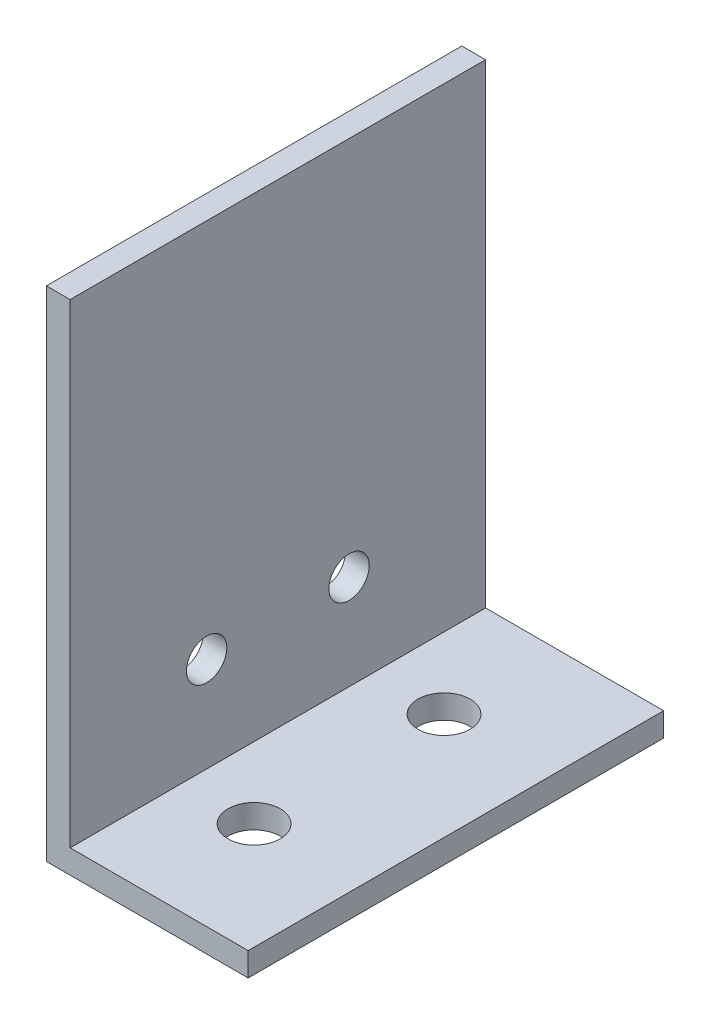
from build123d import *

# Parameters (mm, degrees)
EXTRUDE_1_DEPTH     = 35
CUT_EXTRUDE_1_REACH = 57.803
SKETCH_2_R          = 2.2
SKETCH_3_R          = 1.7
CUT_EXTRUDE_2_DEPTH = 58.253820833


with BuildPart() as part:
    # 草图1 → 凸台-拉伸1 (new body)
    with BuildSketch(Plane.XY):
        Polygon((0, 0), (0, 42), (2, 42), (2, 2), (17, 2), (17, 0), align=None)
    extrude(amount=EXTRUDE_1_DEPTH)

    # 草图2 → 切除-拉伸1 (cut, up to next)
    with BuildSketch(Plane(origin=(0, 2, 0), x_dir=(1, 0, 0), z_dir=(0, 1, 0)), mode=Mode.PRIVATE) as cut_extrude_1_sk1:
        with Locations(Location((8, -9.5, 0), (0, 0, 180))):
            Circle(SKETCH_2_R)
    cut_extrude_1_tool1 = extrude(cut_extrude_1_sk1.sketch, amount=-CUT_EXTRUDE_1_REACH, mode=Mode.PRIVATE) & part.part
    # 草图2 → 切除-拉伸1 (cut, up to next)
    with BuildSketch(Plane(origin=(0, 2, 0), x_dir=(1, 0, 0), z_dir=(0, 1, 0)), mode=Mode.PRIVATE) as cut_extrude_1_sk2:
        with Locations(Location((8, -25.5, 0), (0, 0, 180))):
            Circle(SKETCH_2_R)
    cut_extrude_1_tool2 = extrude(cut_extrude_1_sk2.sketch, amount=-CUT_EXTRUDE_1_REACH, mode=Mode.PRIVATE) & part.part
    add(cut_extrude_1_tool1.solids().sort_by_distance((8, 2, 9.5))[0], mode=Mode.SUBTRACT)
    add(cut_extrude_1_tool2.solids().sort_by_distance((8, 2, 25.5))[0], mode=Mode.SUBTRACT)

    # 草图3 → 切除-拉伸2 (cut, through all)
    with BuildSketch(Plane.ZY):
        with Locations(Location((11.5, 10, 0), (0, 0, 270))):
            Circle(SKETCH_3_R)
        with Locations(Location((23.5, 10, 0), (0, 0, 270))):
            Circle(SKETCH_3_R)
    extrude(amount=-CUT_EXTRUDE_2_DEPTH, mode=Mode.SUBTRACT)


solid = part.part
